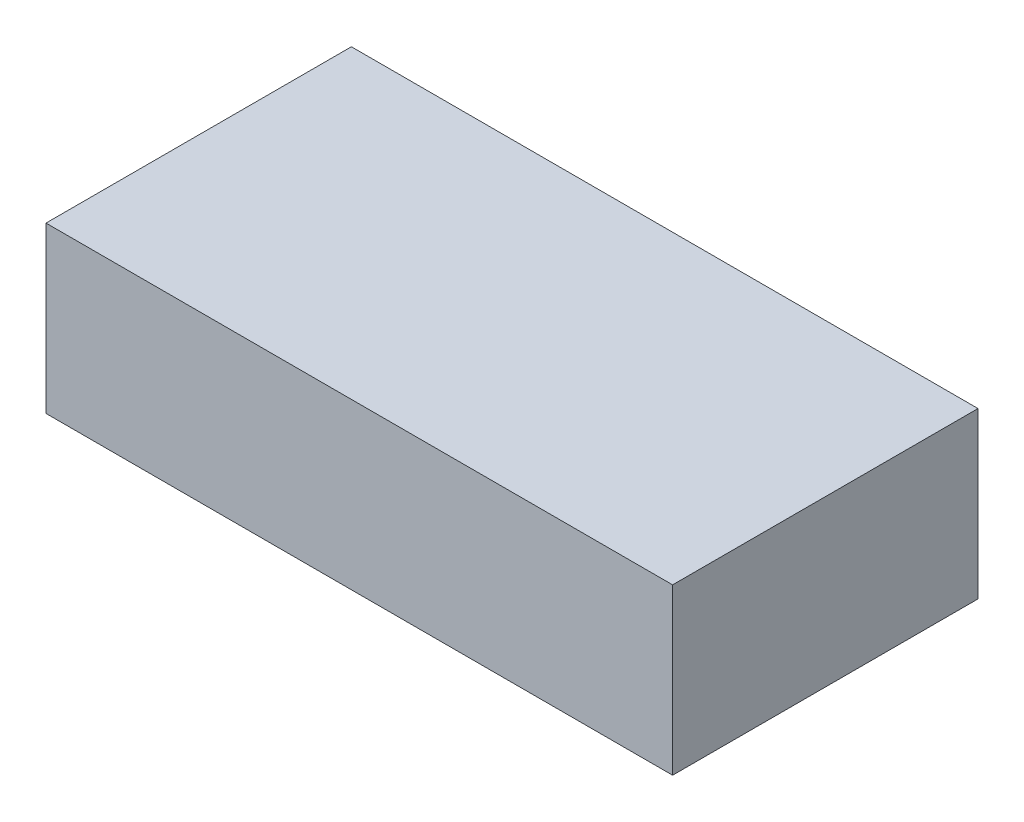
from build123d import *

# Parameters (mm, degrees)
SKETCH1_W           = 241.3
SKETCH1_H           = 117.602
BOSS_EXTRUDE1_DEPTH = 63.5


with BuildPart() as part:
    # Sketch1 → Boss-Extrude1 (new body)
    with BuildSketch(Plane(origin=(0, 0, 0), x_dir=(1, 0, 0), z_dir=(0, 1, 0))):
        with Locations((120.65, 58.801)):
            Rectangle(SKETCH1_W, SKETCH1_H)
    extrude(amount=BOSS_EXTRUDE1_DEPTH)


solid = part.part
